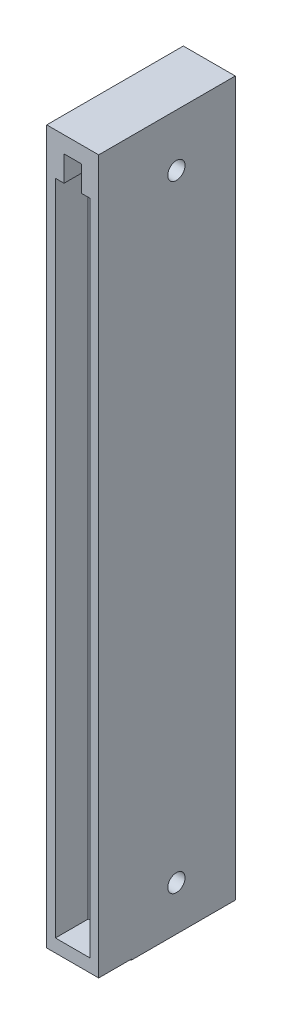
from build123d import *

# Parameters (mm, degrees)
SKETCH1_W               = 3.5
SKETCH1_H               = 11.179611651
BOSS_EXTRUDE1_DEPTH     = 6.89
CUT_EXTRUDE1_DEPTH      = 10.908590231
CUT_EXTRUDE1_DEPTH_BACK = 10.908590231
SKETCH3_R               = 0.5
SKETCH4_W               = 0.5
SKETCH4_H               = 6.89
CUT_EXTRUDE2_DEPTH      = 15
SKETCH5_W               = 3
SKETCH5_H               = 6.89
BOSS_EXTRUDE2_DEPTH     = 13
SKETCH6_W               = 3
SKETCH6_H               = 6.89
BOSS_EXTRUDE3_DEPTH     = 17
SKETCH7_W               = 1.997637341
SKETCH7_H               = 38.005773156
CUT_EXTRUDE3_DEPTH      = 36.891646659
BOSS_EXTRUDE4_REACH     = 37.776
SKETCH8_W               = 6
SKETCH8_H               = 41.231307055
CUT_EXTRUDE4_DEPTH      = 36.826841099
CUT_EXTRUDE4_DEPTH_BACK = 36.826841099
SKETCH9_R               = 0.5
SKETCH10_W              = 1
SKETCH10_H              = 36.442912435
CUT_EXTRUDE5_DEPTH      = 42
CUT_EXTRUDE6_DEPTH      = 36.826841099
CUT_EXTRUDE6_DEPTH_BACK = 36.826841099
SKETCH11_R              = 0.5


with BuildPart() as part:
    # Sketch1 → Boss-Extrude1 (new body)
    with BuildSketch(Plane.XY):
        with Locations((-2.905339806, 0.611650485)):
            Rectangle(SKETCH1_W, SKETCH1_H)
    extrude(amount=BOSS_EXTRUDE1_DEPTH)

    # Sketch3 → Cut-Extrude1 (cut, two sides: drawn at the far end of the back side and taken through both)
    with BuildSketch(Plane(origin=(-1.155339806, 0, 0), x_dir=(0, 0, -1), z_dir=(1, 0, 0)).offset(-CUT_EXTRUDE1_DEPTH_BACK)):
        with Locations((-2, 4.896048014)):
            Circle(SKETCH3_R)
    extrude(amount=CUT_EXTRUDE1_DEPTH + CUT_EXTRUDE1_DEPTH_BACK, mode=Mode.SUBTRACT)

    # Sketch4 → Cut-Extrude2 (cut)
    with BuildSketch(Plane.XZ.offset(4.97815534)):
        with Locations((-4.405339806, 3.445)):
            Rectangle(SKETCH4_W, SKETCH4_H)
    extrude(amount=-CUT_EXTRUDE2_DEPTH, mode=Mode.SUBTRACT)

    # Sketch5 → Boss-Extrude2 (add)
    with BuildSketch(Plane.XZ.offset(4.97815534)):
        with Locations((-2.655339806, 3.445)):
            Rectangle(SKETCH5_W, SKETCH5_H)
    extrude(amount=BOSS_EXTRUDE2_DEPTH)

    # Sketch6 → Boss-Extrude3 (add)
    with BuildSketch(Plane.XZ.offset(17.97815534)):
        with Locations((-2.655339806, 3.445)):
            Rectangle(SKETCH6_W, SKETCH6_H)
    extrude(amount=BOSS_EXTRUDE3_DEPTH)

    # Sketch7 → Cut-Extrude3 (cut, through all)
    with BuildSketch(Plane(origin=(0, 0, 0), x_dir=(-1, 0, 0), z_dir=(0, 0, -1))):
        with Locations((2.655339806, -15.222333021)):
            Rectangle(SKETCH7_W, SKETCH7_H)
    extrude(amount=-CUT_EXTRUDE3_DEPTH, mode=Mode.SUBTRACT)

    # Boss-Extrude4: up to this face of the body (flat: up to its plane)
    boss_extrude4_end = Plane(part.part.faces().sort_by_distance((-1.155339806, -14.44187965, 3.449011069))[0])
    # Sketch8 → Boss-Extrude4 (add, up to the picked face)
    with BuildSketch(Plane.ZY.offset(4.155339806), mode=Mode.PRIVATE) as boss_extrude4_sk1:
        with Locations((2, -14.414197216)):
            Rectangle(SKETCH8_W, SKETCH8_H)
    boss_extrude4_tool1 = split(extrude(boss_extrude4_sk1.sketch, amount=-BOSS_EXTRUDE4_REACH, mode=Mode.PRIVATE), bisect_by=boss_extrude4_end, keep=Keep.BOTH, mode=Mode.PRIVATE)
    add(boss_extrude4_tool1.solids().sort_by(Axis((-4.15534, -14.414197, 2), (1, 0, 0)))[0])

    # Sketch9 → Cut-Extrude4 (cut, two sides: drawn at the far end of the back side and taken through both)
    with BuildSketch(Plane.ZY.offset(4.155339806).offset(-CUT_EXTRUDE4_DEPTH_BACK)):
        with Locations((2.4, -32.452738379)):
            Circle(SKETCH9_R)
    extrude(amount=CUT_EXTRUDE4_DEPTH + CUT_EXTRUDE4_DEPTH_BACK, mode=Mode.SUBTRACT)

    # Sketch10 → Cut-Extrude5 (cut)
    with BuildSketch(Plane(origin=(0, 0, -1), x_dir=(-1, 0, 0), z_dir=(0, 0, -1))):
        with Locations((2.655339806, -12.970585166)):
            Rectangle(SKETCH10_W, SKETCH10_H)
    extrude(amount=-CUT_EXTRUDE5_DEPTH, mode=Mode.SUBTRACT)

    # Sketch11 → Cut-Extrude6 (cut, two sides: drawn at the far end of the back side and taken through both)
    with BuildSketch(Plane.ZY.offset(4.155339806).offset(-CUT_EXTRUDE6_DEPTH_BACK)):
        with Locations((2.4, 3.176876258)):
            Circle(SKETCH11_R)
    extrude(amount=CUT_EXTRUDE6_DEPTH + CUT_EXTRUDE6_DEPTH_BACK, mode=Mode.SUBTRACT)


solid = part.part
